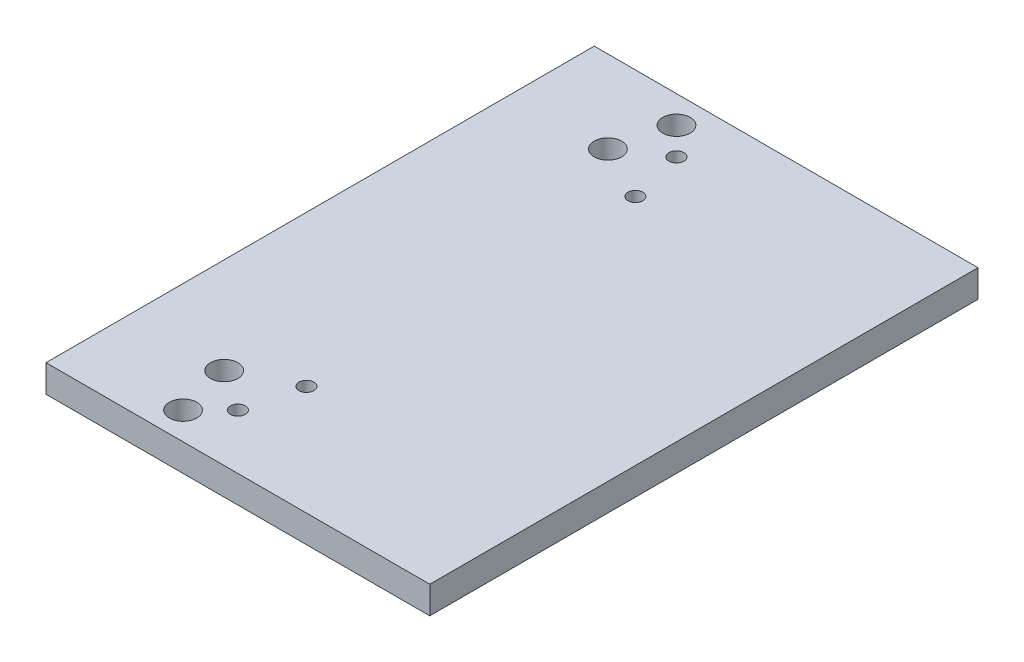
from build123d import *

# Parameters (mm, degrees)
SKETCH1_W                  = 88.9
SKETCH1_H                  = 127
BOSS_EXTRUDE1_DEPTH        = 6.35
F_1_4_0_2500_DOWEL_HOLE1_D = 6.35
F_8_32_TAPPED_HOLE1_D      = 3.4544
F_1_4_0_2500_DOWEL_HOLE2_D = 6.35
F_8_32_TAPPED_HOLE2_D      = 3.4544


with BuildPart() as part:
    # Sketch1 → Boss-Extrude1 (new body)
    with BuildSketch(Plane(origin=(0, 0, 0), x_dir=(1, 0, 0), z_dir=(0, 1, 0))):
        Rectangle(SKETCH1_W, SKETCH1_H)
    extrude(amount=BOSS_EXTRUDE1_DEPTH)

    # 1/4 (0.2500) Dowel Hole1 (through all)
    with Locations(Plane(origin=(0, 6.35, 0), x_dir=(1, 0, 0), z_dir=(0, 1, 0))):
        with Locations((-22.225, -44.45), (-22.225, 44.45)):
            Hole(F_1_4_0_2500_DOWEL_HOLE1_D / 2)

    # #8-32 Tapped Hole1 (through all)
    with Locations(Plane(origin=(0, 6.35, 0), x_dir=(1, 0, 0), z_dir=(0, 1, 0))):
        with Locations((-9.525, -38.1), (-9.525, 38.1)):
            Hole(F_8_32_TAPPED_HOLE1_D / 2)

    # 1/4 (0.2500) Dowel Hole2 (through all)
    with Locations(Plane(origin=(0, 6.35, 0), x_dir=(1, 0, 0), z_dir=(0, 1, 0))):
        with Locations((-19.05, 57.15), (-19.05, -57.15)):
            Hole(F_1_4_0_2500_DOWEL_HOLE2_D / 2)

    # #8-32 Tapped Hole2 (through all)
    with Locations(Plane(origin=(0, 6.35, 0), x_dir=(1, 0, 0), z_dir=(0, 1, 0))):
        with Locations((-12.7, 50.8), (-12.7, -50.8)):
            Hole(F_8_32_TAPPED_HOLE2_D / 2)


solid = part.part
